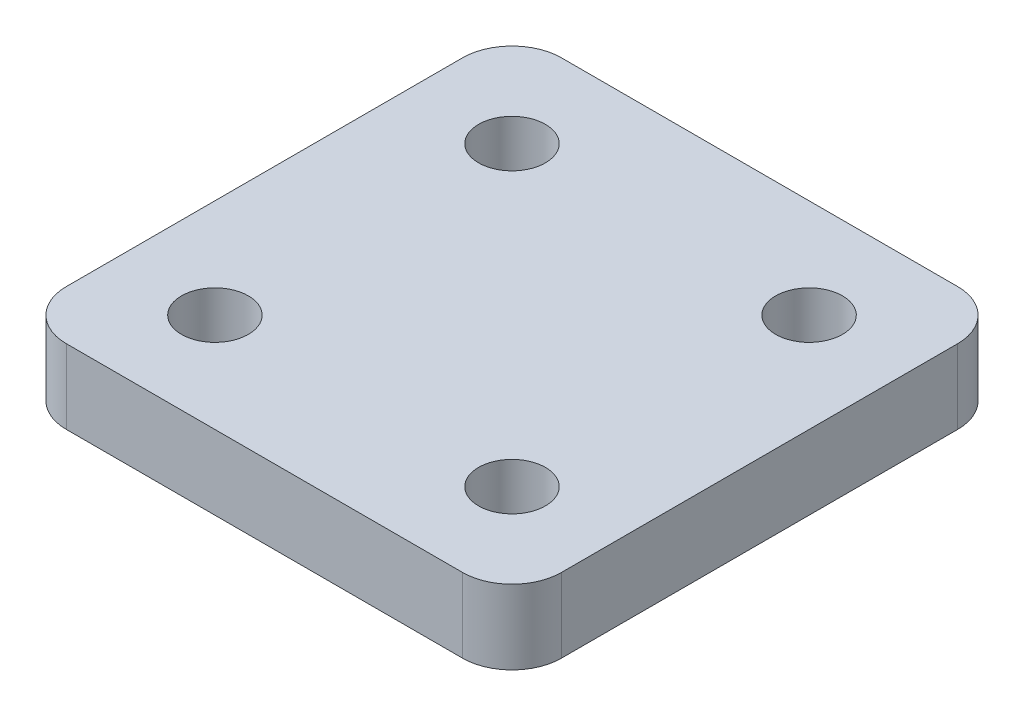
from build123d import *

# Parameters (mm, degrees)
SKETCH_1_W      = 20
SKETCH_1_H      = 20
SKETCH_1_R      = 1.35
EXTRUDE_1_DEPTH = 3
FILLET_1_R      = 2


with BuildPart() as part:
    # 草图1 → 凸台-拉伸1 (new body)
    with BuildSketch(Plane(origin=(0, 0, 0), x_dir=(1, 0, 0), z_dir=(0, 1, 0))):
        Rectangle(SKETCH_1_W, SKETCH_1_H)
        with Locations(Location((-6, 6, 0), (0, 0, 270))):
            Circle(SKETCH_1_R, mode=Mode.SUBTRACT)
        with Locations(Location((6, 6, 0), (0, 0, 90))):
            Circle(SKETCH_1_R, mode=Mode.SUBTRACT)
        with Locations(Location((6, -6, 0), (0, 0, 270))):
            Circle(SKETCH_1_R, mode=Mode.SUBTRACT)
        with Locations(Location((-6, -6, 0), (0, 0, 90))):
            Circle(SKETCH_1_R, mode=Mode.SUBTRACT)
    extrude(amount=EXTRUDE_1_DEPTH)

    # 圆角1
    fillet_1_edges = [part.edges().sort_by_distance(p)[0] for p in [
        (10, 1.5, 10),
        (-10, 1.5, 10),
        (-10, 1.5, -10),
        (10, 1.5, -10),
    ]]
    fillet(fillet_1_edges, radius=FILLET_1_R)


solid = part.part
